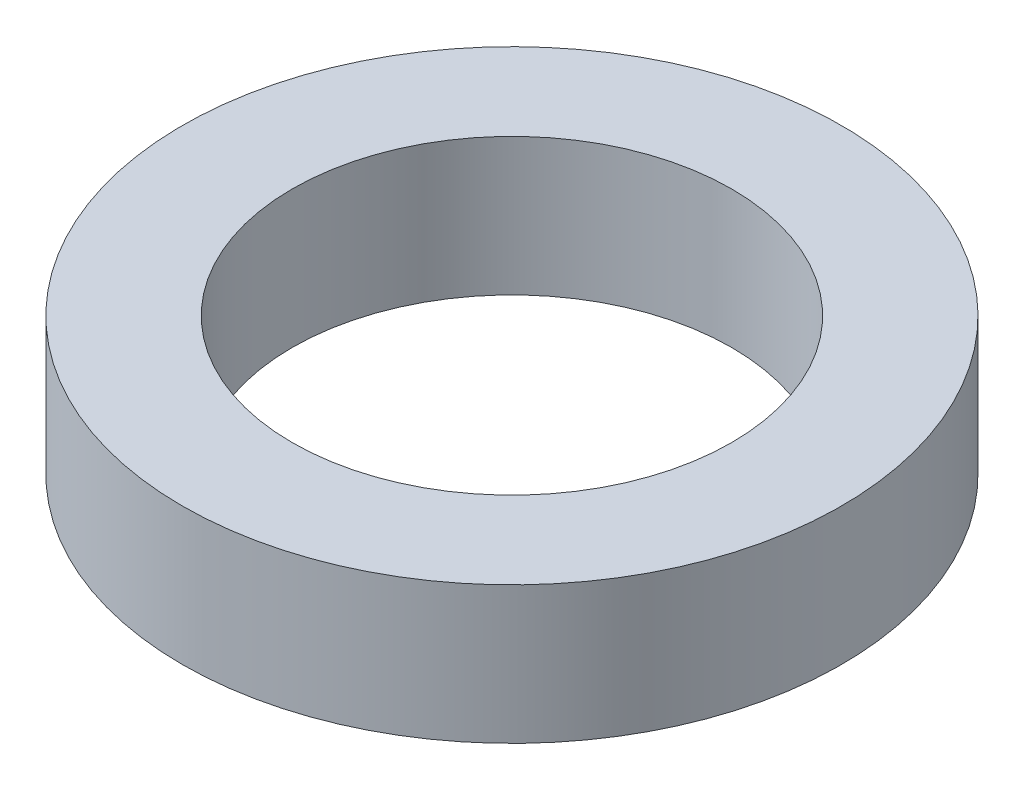
from build123d import *

# Parameters (mm, degrees)
SKETCH1_R           = 9.525
SKETCH1_R_2         = 6.35
BOSS_EXTRUDE1_DEPTH = 3.96875


with BuildPart() as part:
    # Sketch1 → Boss-Extrude1 (new body)
    with BuildSketch(Plane(origin=(0, 0, 0), x_dir=(1, 0, 0), z_dir=(0, 1, 0))):
        with Locations(Location((0, 0, 0), (0, 0, 270))):
            Circle(SKETCH1_R)
        with Locations(Location((0, 0, 0), (0, 0, 270))):
            Circle(SKETCH1_R_2, mode=Mode.SUBTRACT)
    extrude(amount=BOSS_EXTRUDE1_DEPTH)


solid = part.part
